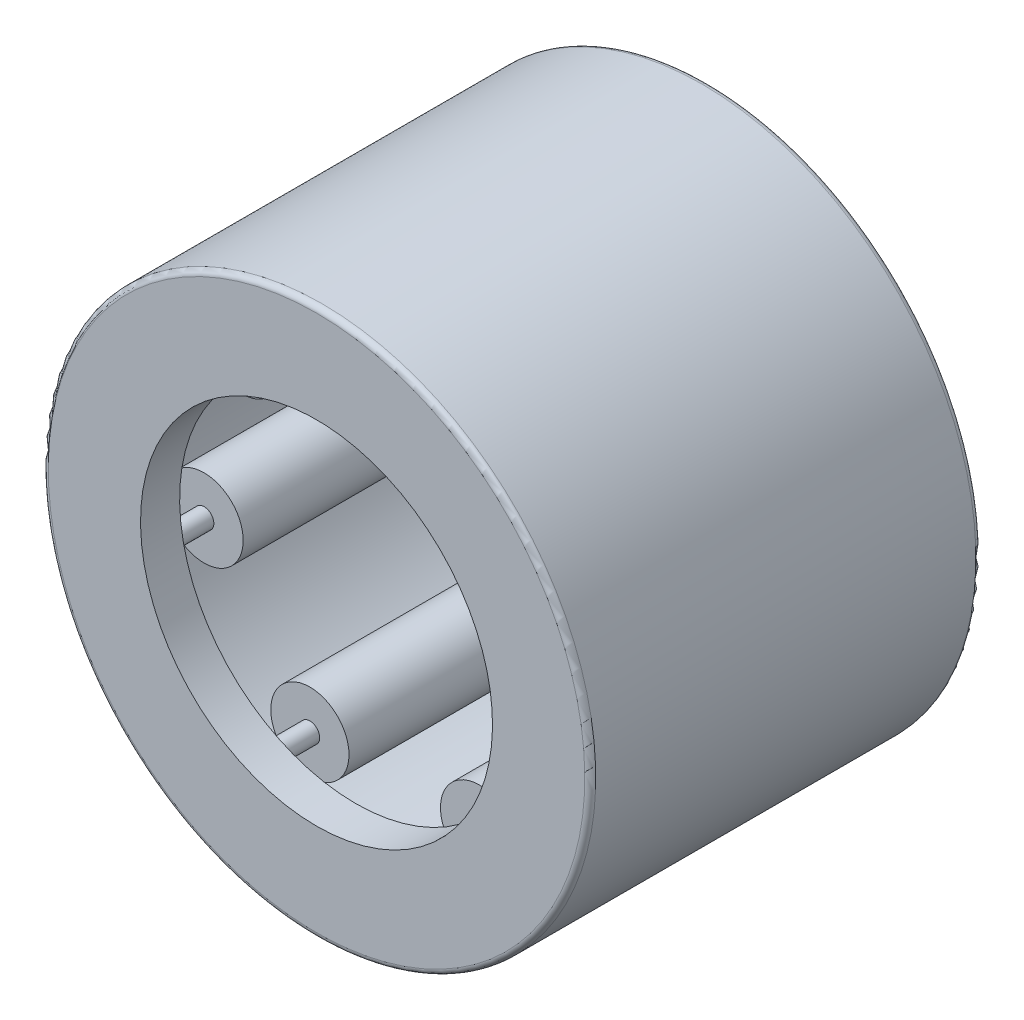
from build123d import *

# Parameters (mm, degrees)
SKETCH2_W         = 4.7625
SKETCH2_H         = 0.5953125
SKETCH3_W         = 6.35
SKETCH3_H         = 0.1984375
CIRPATTERN1_COUNT = 7
CIRPATTERN1_ANGLE = 308.571428571
FILLET1_R         = 0.111125


with BuildPart() as part:
    # Sketch1 → Revolve1 (revolve)
    with BuildSketch(Plane(origin=(0, 0, 0), x_dir=(0, 0, -1), z_dir=(1, 0, 0)), mode=Mode.PRIVATE) as revolve1_sk:
        Polygon((-3.96875, 5.55625), (3.96875, 5.55625), (3.96875, 3.571875), (3.175, 3.571875), (3.175, 4.7625), (-3.175, 4.7625), (-3.175, 3.571875), (-3.96875, 3.571875), align=None)
    revolve(revolve1_sk.sketch.rotate(Axis((0, 0, 3.96875), (0, 0, -1)), 180), axis=Axis((0, 0, 3.96875), (0, 0, -1)))

    # Fillet1
    fillet1_edges = [part.edges().sort_by_distance(p)[0] for p in [
        (0, 5.55625, 3.96875),
        (0, 5.55625, -3.96875),
    ]]
    fillet(fillet1_edges, radius=FILLET1_R)


with BuildPart() as body_2:
    # Sketch2 → Revolve2 (revolve)
    with BuildSketch(Plane(origin=(0, 0, 0), x_dir=(0, 0, -1), z_dir=(1, 0, 0)), mode=Mode.PRIVATE) as revolve2_sk:
        with Locations((0, 4.46484375)):
            Rectangle(SKETCH2_W, SKETCH2_H)
    revolve(revolve2_sk.sketch.rotate(Axis((0, 3.96875, 2.38125), (0, 0, -1)), 90), axis=Axis((0, 3.96875, 2.38125), (0, 0, -1)))


with BuildPart() as body_3:
    # Sketch3 → Revolve3 (revolve)
    with BuildSketch(Plane(origin=(0, 0, 0), x_dir=(0, 0, -1), z_dir=(1, 0, 0))):
        with Locations((0, 4.06796875)):
            Rectangle(SKETCH3_W, SKETCH3_H)
    revolve(axis=Axis((0, 3.96875, 3.175), (0, 0, -1)))


with BuildPart() as cirpattern1_1:
    # CirPattern1: pattern copy
    add(body_2.part.rotate(Axis((0, 0, -3.96875), (0, 0, 1)), 1 * CIRPATTERN1_ANGLE / (CIRPATTERN1_COUNT - 1)))


with BuildPart() as cirpattern1_2:
    # CirPattern1: pattern copy
    add(body_2.part.rotate(Axis((0, 0, -3.96875), (0, 0, 1)), 2 * CIRPATTERN1_ANGLE / (CIRPATTERN1_COUNT - 1)))


with BuildPart() as cirpattern1_3:
    # CirPattern1: pattern copy
    add(body_2.part.rotate(Axis((0, 0, -3.96875), (0, 0, 1)), 3 * CIRPATTERN1_ANGLE / (CIRPATTERN1_COUNT - 1)))


with BuildPart() as cirpattern1_4:
    # CirPattern1: pattern copy
    add(body_2.part.rotate(Axis((0, 0, -3.96875), (0, 0, 1)), 4 * CIRPATTERN1_ANGLE / (CIRPATTERN1_COUNT - 1)))


with BuildPart() as cirpattern1_5:
    # CirPattern1: pattern copy
    add(body_2.part.rotate(Axis((0, 0, -3.96875), (0, 0, 1)), 5 * CIRPATTERN1_ANGLE / (CIRPATTERN1_COUNT - 1)))


with BuildPart() as cirpattern1_6:
    # CirPattern1: pattern copy
    add(body_2.part.rotate(Axis((0, 0, -3.96875), (0, 0, 1)), 6 * CIRPATTERN1_ANGLE / (CIRPATTERN1_COUNT - 1)))


with BuildPart() as cirpattern1_7:
    # CirPattern1: pattern copy
    add(body_3.part.rotate(Axis((0, 0, -3.96875), (0, 0, 1)), 1 * CIRPATTERN1_ANGLE / (CIRPATTERN1_COUNT - 1)))


with BuildPart() as cirpattern1_8:
    # CirPattern1: pattern copy
    add(body_3.part.rotate(Axis((0, 0, -3.96875), (0, 0, 1)), 2 * CIRPATTERN1_ANGLE / (CIRPATTERN1_COUNT - 1)))


with BuildPart() as cirpattern1_9:
    # CirPattern1: pattern copy
    add(body_3.part.rotate(Axis((0, 0, -3.96875), (0, 0, 1)), 3 * CIRPATTERN1_ANGLE / (CIRPATTERN1_COUNT - 1)))


with BuildPart() as cirpattern1_10:
    # CirPattern1: pattern copy
    add(body_3.part.rotate(Axis((0, 0, -3.96875), (0, 0, 1)), 4 * CIRPATTERN1_ANGLE / (CIRPATTERN1_COUNT - 1)))


with BuildPart() as cirpattern1_11:
    # CirPattern1: pattern copy
    add(body_3.part.rotate(Axis((0, 0, -3.96875), (0, 0, 1)), 5 * CIRPATTERN1_ANGLE / (CIRPATTERN1_COUNT - 1)))


with BuildPart() as cirpattern1_12:
    # CirPattern1: pattern copy
    add(body_3.part.rotate(Axis((0, 0, -3.96875), (0, 0, 1)), 6 * CIRPATTERN1_ANGLE / (CIRPATTERN1_COUNT - 1)))


solid = Compound([part.part, body_2.part, body_3.part, cirpattern1_1.part, cirpattern1_2.part, cirpattern1_3.part, cirpattern1_4.part, cirpattern1_5.part, cirpattern1_6.part, cirpattern1_7.part, cirpattern1_8.part, cirpattern1_9.part, cirpattern1_10.part, cirpattern1_11.part, cirpattern1_12.part])
